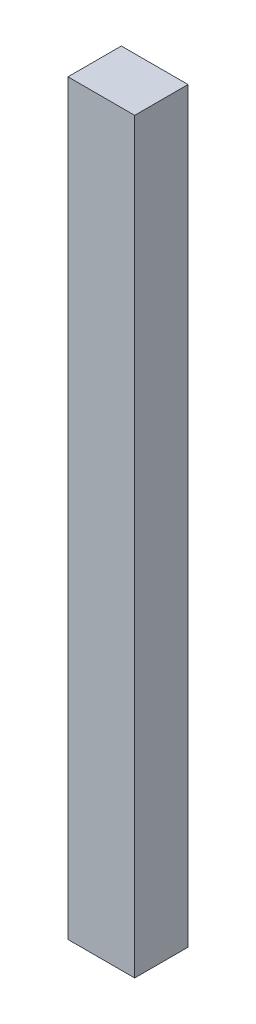
from build123d import *

# Parameters (mm, degrees)
SKETCH1_W                = 25
SKETCH1_H                = 20
FKAP_CERCEVE_SOL_1_DEPTH = 280


with BuildPart() as part:
    # Sketch1 → FKAP_cerceve_sol_1 (new body)
    with BuildSketch(Plane(origin=(0, 0, 0), x_dir=(1, 0, 0), z_dir=(0, 1, 0))):
        with Locations((12.5, -30)):
            Rectangle(SKETCH1_W, SKETCH1_H)
    extrude(amount=FKAP_CERCEVE_SOL_1_DEPTH)


solid = part.part
